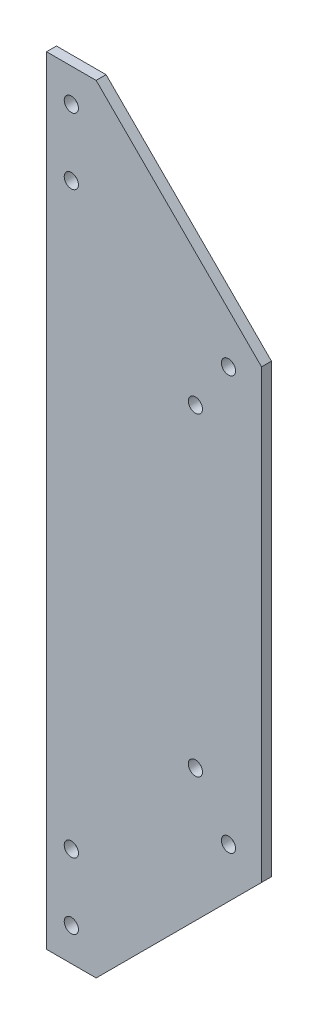
from build123d import *

# Parameters (mm, degrees)
BOSS_EXTRUDE1_DEPTH = 3
SKETCH2_R           = 2.15
CUT_EXTRUDE1_DEPTH  = 3


with BuildPart() as part:
    # Sketch1 → Boss-Extrude1 (new body)
    with BuildSketch(Plane.XY):
        Polygon((-352.325085215, 117.5), (-352.325085215, -117.5), (-337.325085215, -117.5), (-287.325085215, -67.5), (-287.325085215, 67.5), (-337.325085215, 117.5), align=None)
    extrude(amount=BOSS_EXTRUDE1_DEPTH)

    # Sketch2 → Cut-Extrude1 (cut)
    with BuildSketch(Plane(origin=(0, 0, 0), x_dir=(-1, 0, 0), z_dir=(0, 0, -1))):
        with Locations((344.825085215, 107.5)):
            Circle(SKETCH2_R)
        with Locations((344.825085215, 87.5)):
            Circle(SKETCH2_R)
        with Locations(Location((344.825085215, -87.5, 0), (0, 0, 180))):
            Circle(SKETCH2_R)
        with Locations(Location((344.825085215, -107.5, 0), (0, 0, 180))):
            Circle(SKETCH2_R)
        with Locations((297.325085215, 62.5)):
            Circle(SKETCH2_R)
        with Locations((307.325085215, 47.5)):
            Circle(SKETCH2_R)
        with Locations(Location((307.325085215, -47.5, 0), (0, 0, 180))):
            Circle(SKETCH2_R)
        with Locations(Location((297.325085215, -62.5, 0), (0, 0, 180))):
            Circle(SKETCH2_R)
    extrude(amount=-CUT_EXTRUDE1_DEPTH, mode=Mode.SUBTRACT)


solid = part.part
